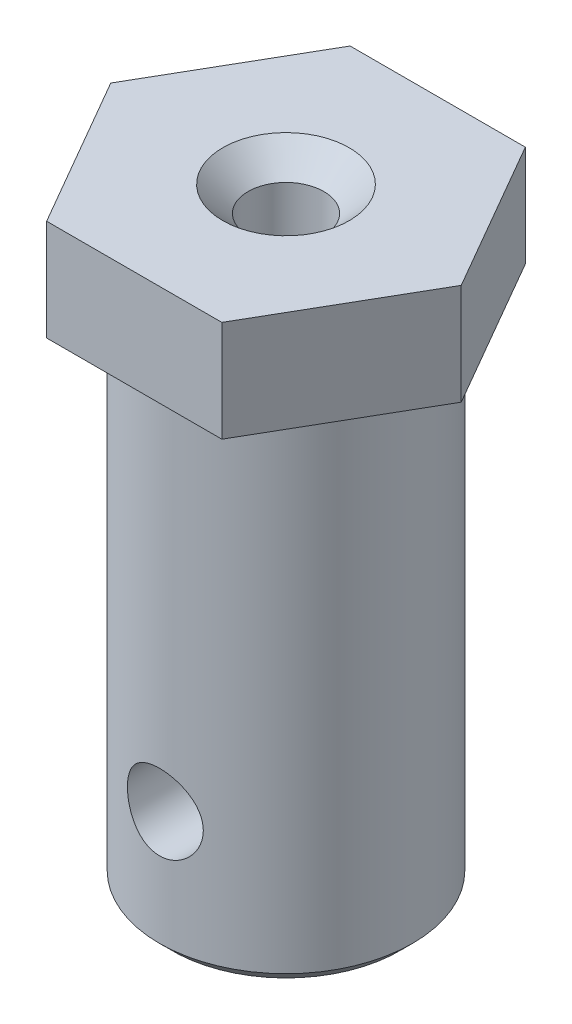
from build123d import *

# Parameters (mm, degrees)
Y_KSEKLIK_EKSTR_ZYON1_DEPTH = 4
IZIM2_R                     = 5
Y_KSEKLIK_EKSTR_ZYON2_DEPTH = 20
RADYUS3_R                   = 0.5
PAH7_SIZE                   = 0.5
IZIM4_R                     = 2.5
KES_EKSTR_ZYON3_DEPTH       = 15
IZIM3_R                     = 1.5
KES_EKSTR_ZYON4_DEPTH       = 10
IZIM8_R                     = 1.5
KES_EKSTR_ZYON5_DEPTH       = 6
PAH8_SIZE                   = 1
PAH9_SIZE                   = 1


with BuildPart() as part:
    # Çizim1 → Yükseklik-Ekstrüzyon1 (new body)
    with BuildSketch(Plane(origin=(0, 0, 0), x_dir=(1, 0, 0), z_dir=(0, 1, 0))):
        Polygon((6.92820323, 0), (3.464101615, 6), (-3.464101615, 6), (-6.92820323, 0), (-3.464101615, -6), (3.464101615, -6), align=None)
    extrude(amount=Y_KSEKLIK_EKSTR_ZYON1_DEPTH)

    # Çizim2 → Yükseklik-Ekstrüzyon2 (add)
    with BuildSketch(Plane.XZ):
        with Locations(Location((0, 0, 0), (0, 0, 270))):
            Circle(IZIM2_R)
    extrude(amount=Y_KSEKLIK_EKSTR_ZYON2_DEPTH)

    # Radyus3
    radyus3_edges = [part.edges().sort_by_distance(p)[0] for p in [
        (0, 0, 5),
    ]]
    fillet(radyus3_edges, radius=RADYUS3_R)

    # Pah7
    pah7_edges = [part.edges().sort_by_distance(p)[0] for p in [
        (0, -20, 5),
    ]]
    chamfer(pah7_edges, length=PAH7_SIZE)

    # Çizim4 → Kes-Ekstrüzyon3 (cut)
    with BuildSketch(Plane.XZ.offset(20)):
        with Locations(Location((0, 0, 0), (0, 0, 270))):
            Circle(IZIM4_R)
    extrude(amount=-KES_EKSTR_ZYON3_DEPTH, mode=Mode.SUBTRACT)

    # Çizim3 → Kes-Ekstrüzyon4 (cut)
    with BuildSketch(Plane(origin=(0, 4, 0), x_dir=(1, 0, 0), z_dir=(0, 1, 0))):
        with Locations(Location((0, 0, 0), (0, 0, 270))):
            Circle(IZIM3_R)
    extrude(amount=-KES_EKSTR_ZYON4_DEPTH, mode=Mode.SUBTRACT)

    # Çizim8 → Kes-Ekstrüzyon5 (cut)
    with BuildSketch(Plane.XY.offset(6)):
        with Locations((0, -15)):
            Circle(IZIM8_R)
    extrude(amount=-KES_EKSTR_ZYON5_DEPTH, mode=Mode.SUBTRACT)

    # Pah8
    pah8_edges = [part.edges().sort_by_distance(p)[0] for p in [
        (0, -20, 2.5),
    ]]
    chamfer(pah8_edges, length=PAH8_SIZE)

    # Pah9
    pah9_edges = [part.edges().sort_by_distance(p)[0] for p in [
        (0, 4, -1.5),
    ]]
    chamfer(pah9_edges, length=PAH9_SIZE)


solid = part.part
